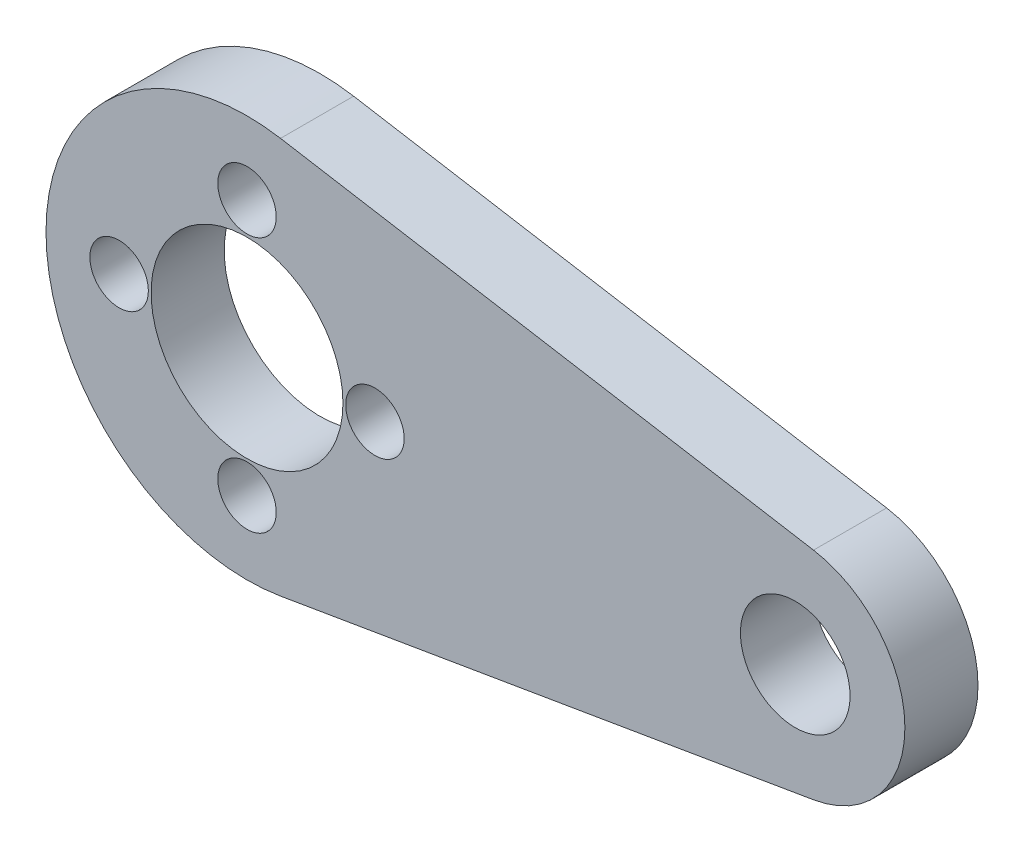
from build123d import *

# Parameters (mm, degrees)
SKETCH_1_R          = 1.6
SKETCH_1_R_2        = 3
EXTRUDE_1_DEPTH     = 4
SKETCH_4_R          = 5.25
CUT_EXTRUDE_3_DEPTH = 38.854986461


with BuildPart() as part:
    # 草图1 → 凸台-拉伸1 (new body)
    with BuildSketch(Plane.XY):
        with BuildLine():
            Line((1.833333333, 10.846146269), (31, 5.916079783))
            ThreePointArc((31, 5.916079783), (36, 0), (31, -5.916079783))
            Line((31, -5.916079783), (1.833333333, -10.846146269))
            ThreePointArc((1.833333333, -10.846146269), (-11, 0), (1.833333333, 10.846146269))
        make_face()
        with Locations((0, 7)):
            Circle(SKETCH_1_R, mode=Mode.SUBTRACT)
        with Locations((-7, 0)):
            Circle(SKETCH_1_R, mode=Mode.SUBTRACT)
        with Locations((0, -7)):
            Circle(SKETCH_1_R, mode=Mode.SUBTRACT)
        with Locations((7, 0)):
            Circle(SKETCH_1_R, mode=Mode.SUBTRACT)
        with Locations((30, 0)):
            Circle(SKETCH_1_R_2, mode=Mode.SUBTRACT)
    extrude(amount=EXTRUDE_1_DEPTH)

    # 草图4 → 切除-拉伸3 (cut, through all)
    with BuildSketch(Plane.XY.offset(4)):
        Circle(SKETCH_4_R)
    extrude(amount=-CUT_EXTRUDE_3_DEPTH, mode=Mode.SUBTRACT)


solid = part.part
